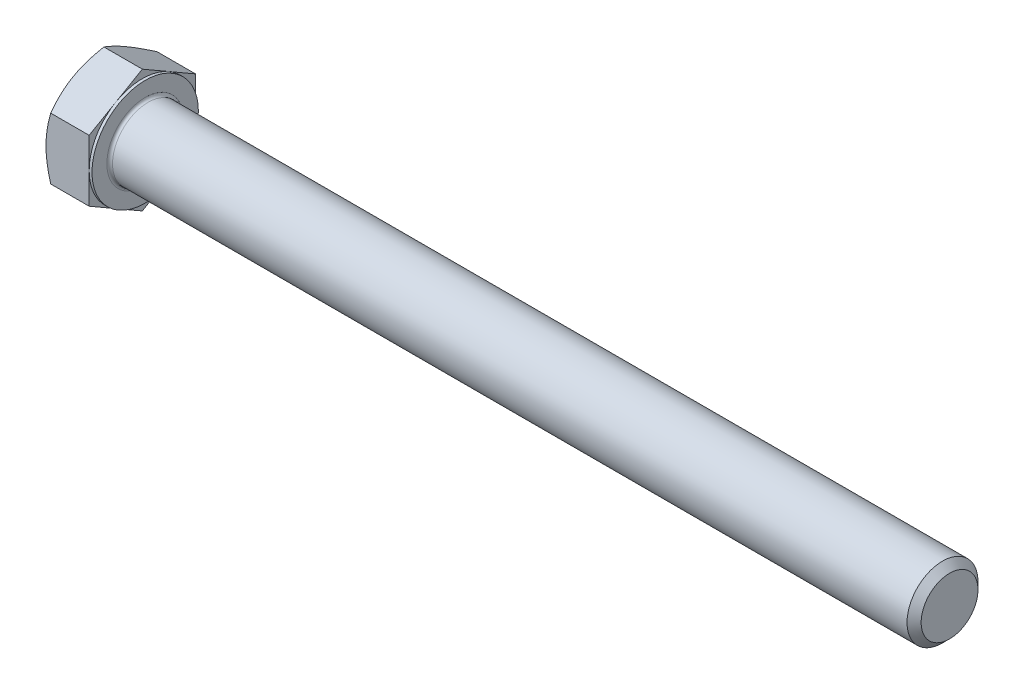
from build123d import *

# Parameters (mm, degrees)
BASEHEAD_DEPTH = 6.1722
SKETCH4_W      = 0.381
SKETCH4_H      = 26.504159623
HEADFILLET_R   = 0.381


with BuildPart() as part:
    # Sketch1 → BaseHead (new body)
    with BuildSketch(Plane(origin=(0, 0, 0), x_dir=(0, 0, -1), z_dir=(1, 0, 0))):
        Polygon((7.1374, 4.120779811), (7.1374, -4.120779811), (0, -8.241559623), (-7.1374, -4.120779811), (-7.1374, 4.120779811), (0, 8.241559623), align=None)
    extrude(amount=BASEHEAD_DEPTH)

    # BodySke → BaseBody (revolve)
    with BuildSketch(Plane.XY, mode=Mode.PRIVATE) as basebody_sk:
        Polygon((0, 0), (114.1222, 0), (114.1222, 3.81635), (113.17605, 4.7625), (0, 4.7625), align=None)
    revolve(basebody_sk.sketch.rotate(Axis((0, 0, 0), (1, 0, 0)), 90), axis=Axis((0, 0, 0), (1, 0, 0)))

    # Sketch3 → HeadChamfer (revolve, cut)
    with BuildSketch(Plane.XY):
        Polygon((0, 7.1374), (4.303661065, 14.591559623), (4.303661065, 20.941559623), (-12.7, 20.941559623), (-12.7, 7.1374), align=None)
    revolve(axis=Axis((0, 0, 0), (1, 0, 0)), mode=Mode.SUBTRACT)

    # Sketch4 → BearingFace (revolve, cut)
    with BuildSketch(Plane.XY, mode=Mode.PRIVATE) as bearingface_sk:
        with Locations((5.9817, 20.389479811)):
            Rectangle(SKETCH4_W, SKETCH4_H)
    revolve(bearingface_sk.sketch.rotate(Axis((0, 0, 0), (1, 0, 0)), 270), axis=Axis((0, 0, 0), (1, 0, 0)), mode=Mode.SUBTRACT)

    # HeadFillet
    headfillet_edges = [part.edges().sort_by_distance(p)[0] for p in [
        (6.1722, 0, -4.7625),
    ]]
    fillet(headfillet_edges, radius=HEADFILLET_R)


solid = part.part
